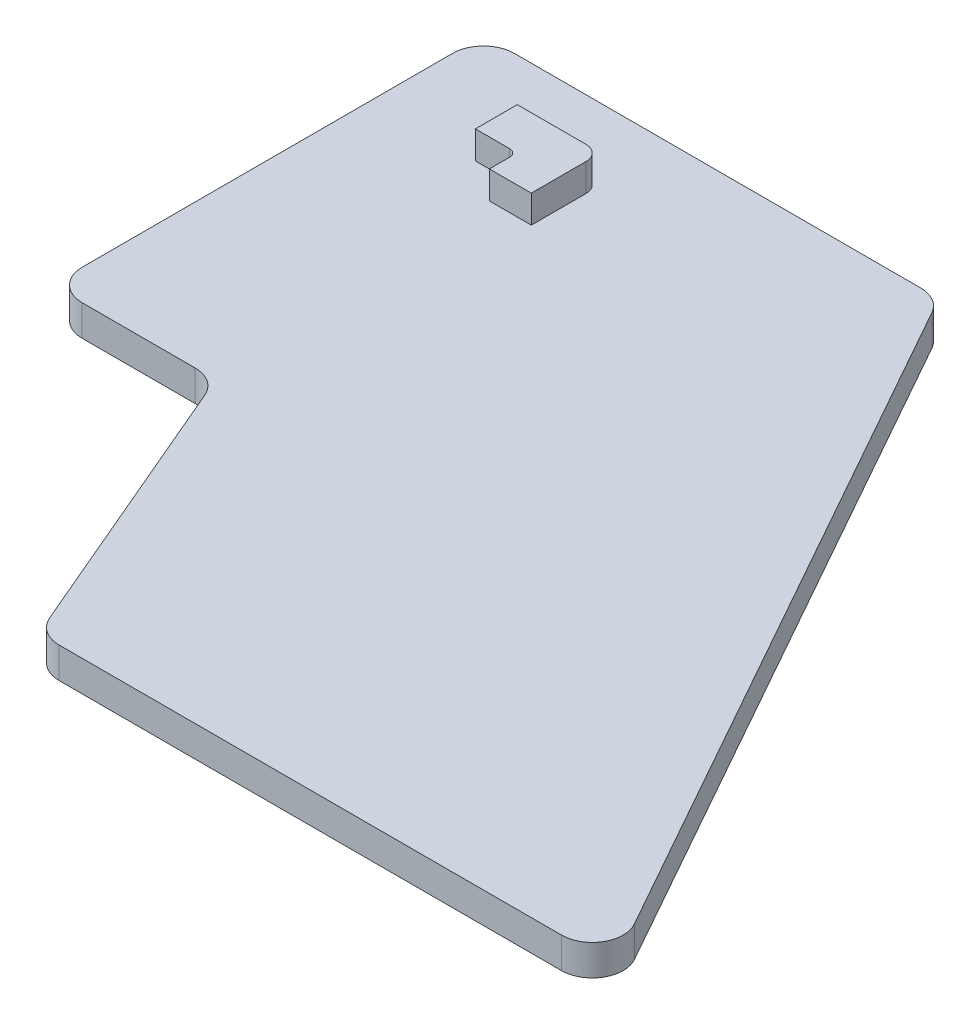
from build123d import *

# Parameters (mm, degrees)
EXTRUDE1_DEPTH = 3.175
EXTRUDE2_DEPTH = 2.8575


with BuildPart() as part:
    # Sketch1 → Extrude1 (new body)
    with BuildSketch(Plane(origin=(0, 0, 0), x_dir=(1, 0, 0), z_dir=(0, 1, 0))):
        with BuildLine():
            Line((3.175, 44.50785877), (45.047498502, 44.50785877))
            ThreePointArc((45.047498502, 44.50785877), (46.651643951, 44.072811758), (47.81618078, 42.886893339))
            Line((47.81618078, 42.886893339), (87.038547596, -26.992036046))
            ThreePointArc((87.038547596, -26.992036046), (87.009818306, -30.150216064), (84.269865318, -31.721070615))
            Line((84.269865318, -31.721070615), (32.528914715, -31.721070615))
            ThreePointArc((32.528914715, -31.721070615), (30.778624678, -31.195053398), (29.608292243, -29.791297251))
            Line((29.608292243, -29.791297251), (17.72934795, -1.929773364))
            ThreePointArc((17.72934795, -1.929773364), (16.559015516, -0.526017217), (14.808725478, 0))
            Line((14.808725478, 0), (3.175, 0))
            ThreePointArc((3.175, 0), (0.92993597, 0.92993597), (0, 3.175))
            Line((0, 3.175), (0, 41.33285877))
            ThreePointArc((0, 41.33285877), (0.92993597, 43.5779228), (3.175, 44.50785877))
        make_face()
    extrude(amount=-EXTRUDE1_DEPTH)

    # Sketch4 → Extrude2 (add, symmetric)
    with BuildSketch(Plane(origin=(0, 0, 0), x_dir=(1, 0, 0), z_dir=(0, 1, 0))):
        with BuildLine():
            Line((10.768757098, 37.225043705), (17.854525476, 37.225043705))
            ThreePointArc((17.854525476, 37.225043705), (18.93215621, 36.77867444), (19.378525476, 35.701043705))
            Line((19.378525476, 35.701043705), (19.378525476, 30.0552377))
            Line((19.378525476, 30.0552377), (15.061814646, 30.0552377))
            Line((15.061814646, 30.0552377), (15.061814646, 32.146332876))
            ThreePointArc((15.061814646, 32.146332876), (14.838630013, 32.685148243), (14.299814646, 32.908332876))
            Line((14.299814646, 32.908332876), (10.768757098, 32.908332876))
            Line((10.768757098, 32.908332876), (10.768757098, 37.225043705))
        make_face()
    extrude(amount=EXTRUDE2_DEPTH, both=True)


solid = part.part
